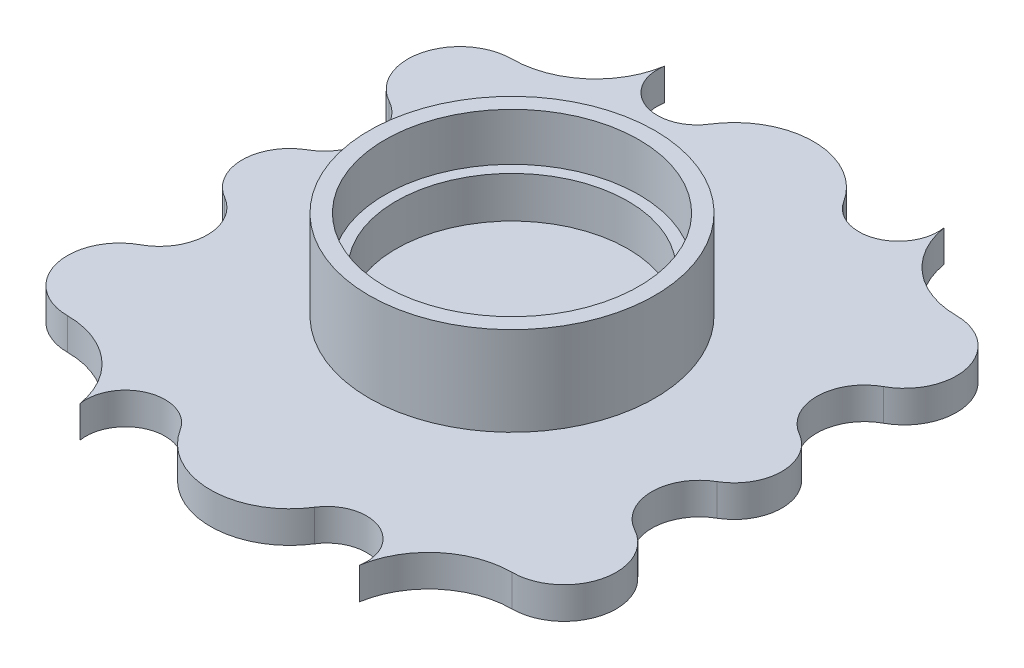
from build123d import *

# Parameters (mm, degrees)
SALIENTE_EXTRUIR1_DEPTH = 10
SALIENTE_EXTRUIR2_DEPTH = 10
CROQUIS3_R              = 40
CROQUIS3_R_2            = 36.5
SALIENTE_EXTRUIR3_DEPTH = 13
CROQUIS4_R              = 45
CROQUIS4_R_2            = 40
SALIENTE_EXTRUIR4_DEPTH = 28


with BuildPart() as part:
    # Croquis1 → Saliente-Extruir1 (new body)
    with BuildSketch(Plane(origin=(0, 0, 0), x_dir=(1, 0, 0), z_dir=(0, 1, 0))):
        with BuildLine():
            Line((-70, -70), (-70, 70))
            ThreePointArc((-70, 70), (-52.983030462, 76.249658661), (-44.055908755, 92.027554074))
            ThreePointArc((-44.055908755, 92.027554074), (-36.156795126, 78.313355526), (-21.147629234, 83.333333333))
            ThreePointArc((-21.147629234, 83.333333333), (0, 95), (21.147629234, 83.333333333))
            ThreePointArc((21.147629234, 83.333333333), (36.156795126, 78.313355526), (44.055908755, 92.027554074))
            ThreePointArc((44.055908755, 92.027554074), (52.983030462, 76.249658661), (70, 70))
            Line((70, 70), (70, -70))
            ThreePointArc((70, -70), (52.983030462, -76.249658661), (44.055908755, -92.027554074))
            ThreePointArc((44.055908755, -92.027554074), (36.156795126, -78.313355526), (21.147629234, -83.333333333))
            ThreePointArc((21.147629234, -83.333333333), (0, -95), (-21.147629234, -83.333333333))
            ThreePointArc((-21.147629234, -83.333333333), (-36.156795126, -78.313355526), (-44.055908755, -92.027554074))
            ThreePointArc((-44.055908755, -92.027554074), (-52.983030462, -76.249658661), (-70, -70))
        make_face()
    extrude(amount=SALIENTE_EXTRUIR1_DEPTH)

    # Croquis2 → Saliente-Extruir2 (add)
    with BuildSketch(Plane(origin=(0, 10, 0), x_dir=(1, 0, 0), z_dir=(0, 1, 0))):
        with BuildLine():
            Line((-70, 25.98076189), (-70, 70))
            ThreePointArc((-70, 70), (-85.909969357, 57.627811916), (-77.837993487, 39.160506523))
            ThreePointArc((-77.837993487, 39.160506523), (-72.107558403, 33.647896498), (-70, 25.98076189))
        make_face()
        with BuildLine():
            ThreePointArc((77.837993487, 39.160506523), (85.909969357, 57.627811916), (70, 70))
            Line((70, 70), (70, 25.98076213))
            ThreePointArc((70, 25.98076213), (72.107558465, 33.647896602), (77.837993487, 39.160506523))
        make_face()
        with BuildLine():
            ThreePointArc((77.5, 12.990381057), (72.009618939, 18.480762121), (70, 25.98076213))
            Line((70, 25.98076213), (70, -25.98076213))
            ThreePointArc((70, -25.98076213), (72.009618939, -18.480762121), (77.5, -12.990381057))
            ThreePointArc((77.5, -12.990381057), (85, 0), (77.5, 12.990381057))
        make_face()
        with BuildLine():
            Line((-70, -25.980762199), (-70, 25.98076189))
            ThreePointArc((-70, 25.98076189), (-72.009618999, 18.480762017), (-77.5, 12.990381057))
            ThreePointArc((-77.5, 12.990381057), (-85, 0), (-77.5, -12.990381057))
            ThreePointArc((-77.5, -12.990381057), (-72.009618922, -18.480762151), (-70, -25.980762199))
        make_face()
        with BuildLine():
            Line((-70, -70), (-70, -25.980762199))
            ThreePointArc((-70, -25.980762199), (-72.107558482, -33.647896631), (-77.837993487, -39.160506523))
            ThreePointArc((-77.837993487, -39.160506523), (-85.909969357, -57.627811916), (-70, -70))
        make_face()
        with BuildLine():
            ThreePointArc((77.837993487, -39.160506523), (72.107558465, -33.647896602), (70, -25.98076213))
            Line((70, -25.98076213), (70, -70))
            ThreePointArc((70, -70), (85.909969357, -57.627811916), (77.837993487, -39.160506523))
        make_face()
    extrude(amount=-SALIENTE_EXTRUIR2_DEPTH)

    # Croquis3 → Saliente-Extruir3 (add)
    with BuildSketch(Plane(origin=(0, 10, 0), x_dir=(1, 0, 0), z_dir=(0, 1, 0))):
        with Locations(Location((0, 0, 0), (0, 0, 90))):
            Circle(CROQUIS3_R)
        with Locations(Location((0, 0, 0), (0, 0, 90))):
            Circle(CROQUIS3_R_2, mode=Mode.SUBTRACT)
    extrude(amount=SALIENTE_EXTRUIR3_DEPTH)

    # Croquis4 → Saliente-Extruir4 (add)
    with BuildSketch(Plane(origin=(0, 10, 0), x_dir=(1, 0, 0), z_dir=(0, 1, 0))):
        with Locations(Location((0, 0, 0), (0, 0, 270))):
            Circle(CROQUIS4_R)
        with Locations(Location((0, 0, 0), (0, 0, 270))):
            Circle(CROQUIS4_R_2, mode=Mode.SUBTRACT)
    extrude(amount=SALIENTE_EXTRUIR4_DEPTH)


solid = part.part
